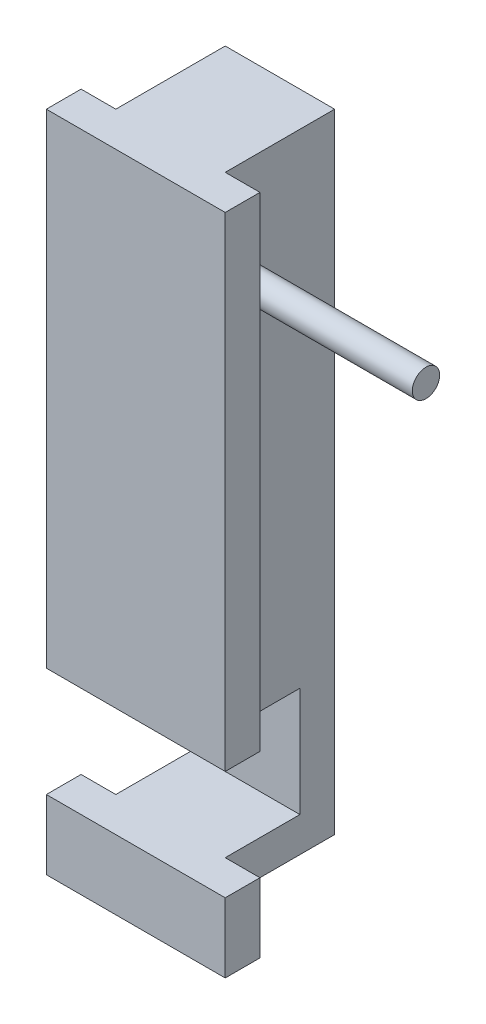
from build123d import *

# Parameters (mm, degrees)
BOSS_EXTRUDE1_DEPTH = 32.7
SKETCH3_W           = 6.35
SKETCH3_H           = 20
CUT_EXTRUDE2_DEPTH  = 129.269452716
SKETCH4_R           = 2.5
BOSS_EXTRUDE2_DEPTH = 33.05


with BuildPart() as part:
    # Sketch2 → Boss-Extrude1 (new body)
    with BuildSketch(Plane(origin=(0, 0, 0), x_dir=(0, 0, -1), z_dir=(1, 0, 0))):
        Polygon((0, 0), (20, 0), (20, -20), (0, -20), (0, -32.7), (6.35, -32.7), (6.35, -26.35), (26.35, -26.35), (26.35, 88.5), (0, 88.5), align=None)
    extrude(amount=BOSS_EXTRUDE1_DEPTH)

    # Sketch3 → Cut-Extrude2 (cut, through all)
    with BuildSketch(Plane(origin=(0, 88.5, 0), x_dir=(1, 0, 0), z_dir=(0, 1, 0))):
        with Locations((3.175, 16.35)):
            Rectangle(SKETCH3_W, SKETCH3_H)
        with Locations((29.525, 16.35)):
            Rectangle(SKETCH3_W, SKETCH3_H)
    extrude(amount=-CUT_EXTRUDE2_DEPTH, mode=Mode.SUBTRACT)

    # Sketch4 → Boss-Extrude2 (add)
    with BuildSketch(Plane(origin=(26.35, 0, 0), x_dir=(0, 0, -1), z_dir=(1, 0, 0))):
        with Locations(Location((10, 69.86, 0), (0, 0, 180))):
            Circle(SKETCH4_R)
    extrude(amount=BOSS_EXTRUDE2_DEPTH)


solid = part.part
